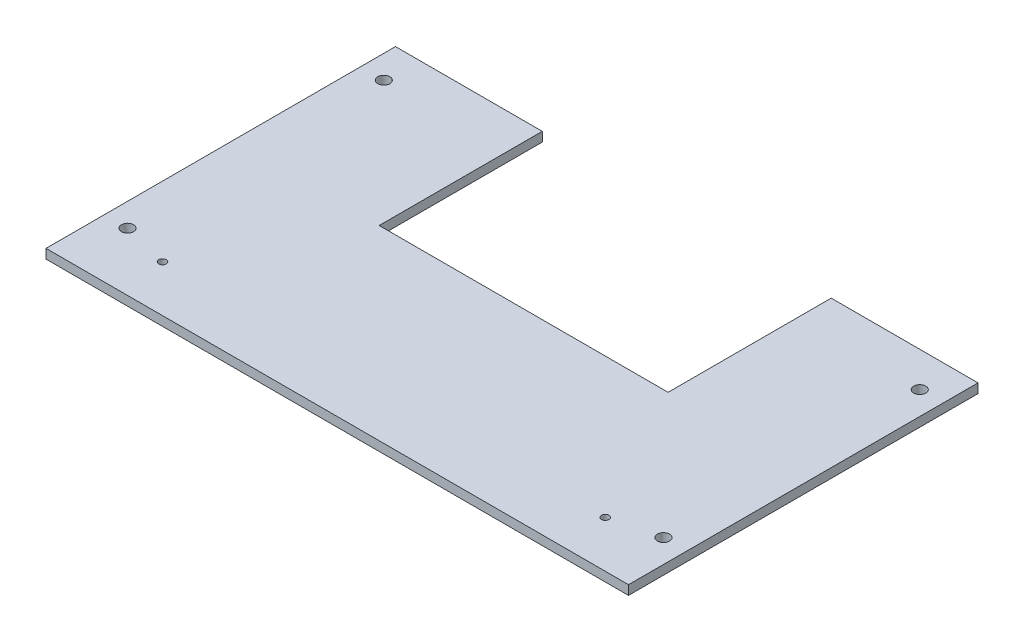
from build123d import *

# Parameters (mm, degrees)
CROQUIS1_W              = 250
CROQUIS1_H              = 150
SALIENTE_EXTRUIR1_DEPTH = 4
CROQUIS2_R              = 2.6
CROQUIS2_W              = 124
CROQUIS2_H              = 70
CORTAR_EXTRUIR1_DEPTH   = 4
CROQUIS3_R              = 1.6
CORTAR_EXTRUIR2_DEPTH   = 10


with BuildPart() as part:
    # Croquis1 → Saliente-Extruir1 (new body)
    with BuildSketch(Plane(origin=(0, 0, 0), x_dir=(1, 0, 0), z_dir=(0, 1, 0))):
        Rectangle(CROQUIS1_W, CROQUIS1_H)
    extrude(amount=SALIENTE_EXTRUIR1_DEPTH)

    # Croquis2 → Cortar-Extruir1 (cut)
    with BuildSketch(Plane(origin=(0, 4, 0), x_dir=(1, 0, 0), z_dir=(0, 1, 0))):
        with Locations(Location((-115, 60, 0), (0, 0, 270))):
            Circle(CROQUIS2_R)
        with Locations(Location((115, 60, 0), (0, 0, 270))):
            Circle(CROQUIS2_R)
        with Locations(Location((115, -50, 0), (0, 0, 270))):
            Circle(CROQUIS2_R)
        with Locations(Location((-115, -50, 0), (0, 0, 270))):
            Circle(CROQUIS2_R)
        with Locations((0, 40)):
            Rectangle(CROQUIS2_W, CROQUIS2_H)
    extrude(amount=-CORTAR_EXTRUIR1_DEPTH, mode=Mode.SUBTRACT)

    # Croquis3 → Cortar-Extruir2 (cut)
    with BuildSketch(Plane(origin=(0, 4, 0), x_dir=(1, 0, 0), z_dir=(0, 1, 0))):
        with Locations(Location((95, -55, 0), (0, 0, 270))):
            Circle(CROQUIS3_R)
        with Locations(Location((-95, -55, 0), (0, 0, 270))):
            Circle(CROQUIS3_R)
    extrude(amount=-CORTAR_EXTRUIR2_DEPTH, mode=Mode.SUBTRACT)


solid = part.part
